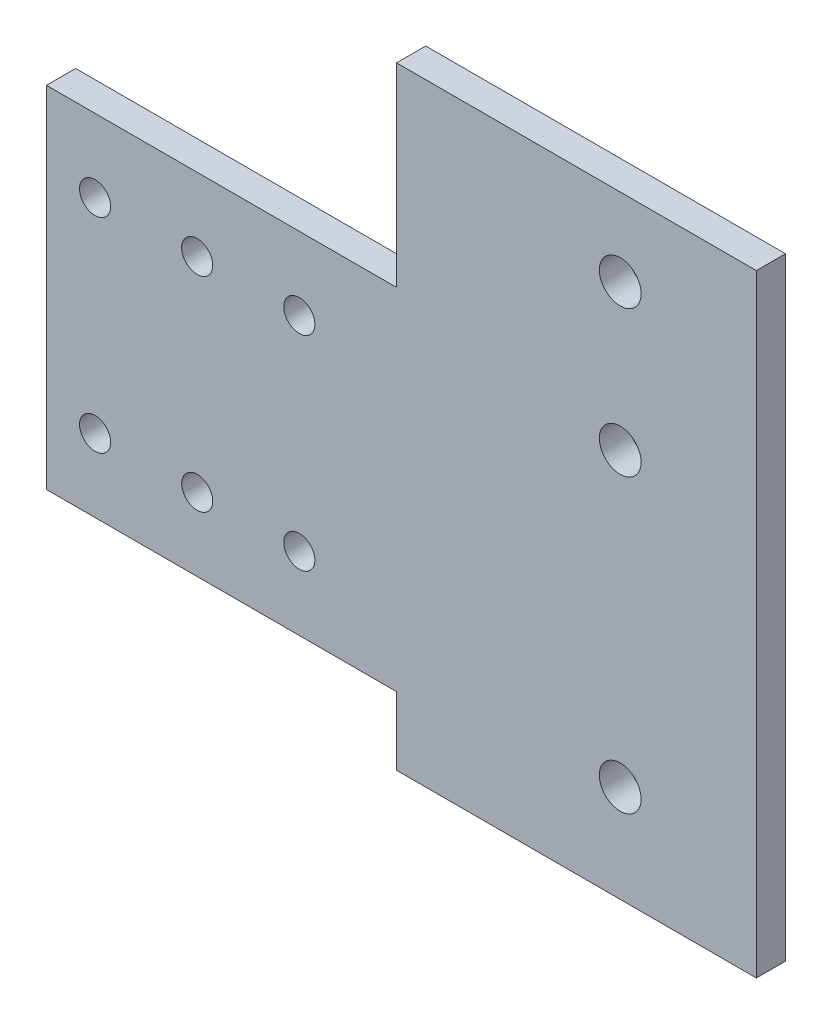
from build123d import *

# Parameters (mm, degrees)
EXTRUDE_1_DEPTH     = 3
SKETCH_2_R          = 1.6
CUT_EXTRUDE_1_DEPTH = 93.054331783
SKETCH_3_R          = 2.15
CUT_EXTRUDE_2_DEPTH = 93.054331783
SKETCH_4_R          = 2.15
CUT_EXTRUDE_3_DEPTH = 93.054331783
SKETCH_5_W          = 37
SKETCH_5_H          = 13
CUT_EXTRUDE_4_DEPTH = 93.054331783


with BuildPart() as part:
    # 草图1 → 凸台-拉伸1 (new body)
    with BuildSketch(Plane.XY):
        Polygon((0, 0), (36, 0), (36, 20), (73, 20), (73, -56), (36, -56), (36, -36), (0, -36), align=None)
    extrude(amount=EXTRUDE_1_DEPTH)

    # 草图2 → 切除-拉伸1 (cut, through all)
    with BuildSketch(Plane(origin=(0, 0, 0), x_dir=(-1, 0, 0), z_dir=(0, 0, -1))):
        with Locations((-26, -7.5)):
            Circle(SKETCH_2_R)
        with Locations((-26, -28.5)):
            Circle(SKETCH_2_R)
        with Locations((-5, -7.5)):
            Circle(SKETCH_2_R)
        with Locations((-5, -28.5)):
            Circle(SKETCH_2_R)
        with Locations((-15.5, -28.5)):
            Circle(SKETCH_2_R)
        with Locations((-15.5, -7.5)):
            Circle(SKETCH_2_R)
    extrude(amount=-CUT_EXTRUDE_1_DEPTH, mode=Mode.SUBTRACT)

    # 草图3 → 切除-拉伸2 (cut, through all)
    with BuildSketch(Plane(origin=(0, 0, 0), x_dir=(-1, 0, 0), z_dir=(0, 0, -1))):
        with Locations((-59, -33)):
            Circle(SKETCH_3_R)
        with Locations((-59, -48)):
            Circle(SKETCH_3_R)
    extrude(amount=-CUT_EXTRUDE_2_DEPTH, mode=Mode.SUBTRACT)

    # 草图4 → 切除-拉伸3 (cut, through all)
    with BuildSketch(Plane(origin=(0, 0, 0), x_dir=(-1, 0, 0), z_dir=(0, 0, -1))):
        with Locations((-59, 12)):
            Circle(SKETCH_4_R)
        with Locations((-59, -3)):
            Circle(SKETCH_4_R)
    extrude(amount=-CUT_EXTRUDE_3_DEPTH, mode=Mode.SUBTRACT)

    # 草图5 → 切除-拉伸4 (cut, through all)
    with BuildSketch(Plane.XY.offset(3)):
        with Locations((54.5, -49.5)):
            Rectangle(SKETCH_5_W, SKETCH_5_H)
    extrude(amount=-CUT_EXTRUDE_4_DEPTH, mode=Mode.SUBTRACT)


solid = part.part
